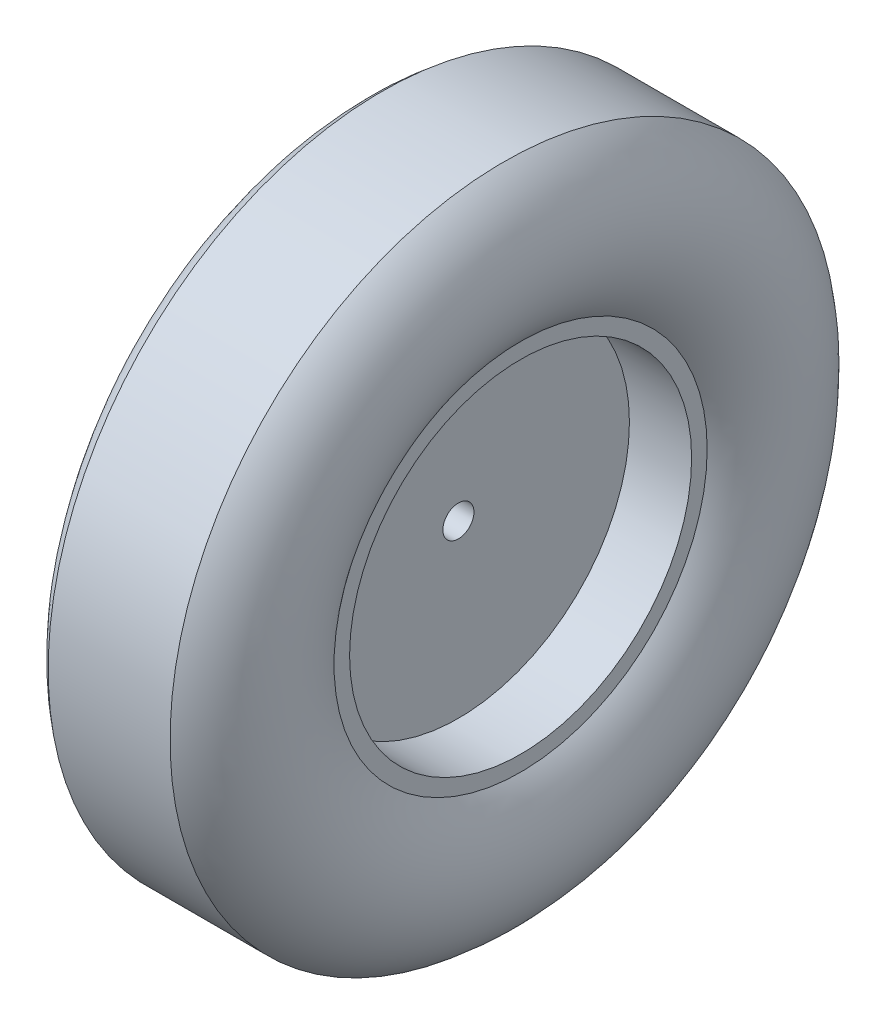
from build123d import *


with BuildPart() as part:
    # Sketch3 → Revolve1 (revolve)
    with BuildSketch(Plane.XY, mode=Mode.PRIVATE) as revolve1_sk:
        Polygon((63.5, 139.7), (63.5, 152.4), (-63.5, 152.4), (-63.5, 139.7), (-12.7, 139.7), (-12.7, 12.7), (12.7, 12.7), (12.7, 139.7), align=None)
        with BuildLine():
            Line((-63.5, 152.4), (63.5, 152.4))
            ThreePointArc((63.5, 152.4), (82.597266275, 215.469039665), (49.79563591, 272.622013244))
            Line((49.79563591, 272.622013244), (-49.79563591, 272.622013244))
            ThreePointArc((-49.79563591, 272.622013244), (-82.597266275, 215.469039665), (-63.5, 152.4))
        make_face()
    revolve(revolve1_sk.sketch.rotate(Axis((12.7, 0, 0), (-1, 0, 0)), 90), axis=Axis((12.7, 0, 0), (-1, 0, 0)))


solid = part.part
